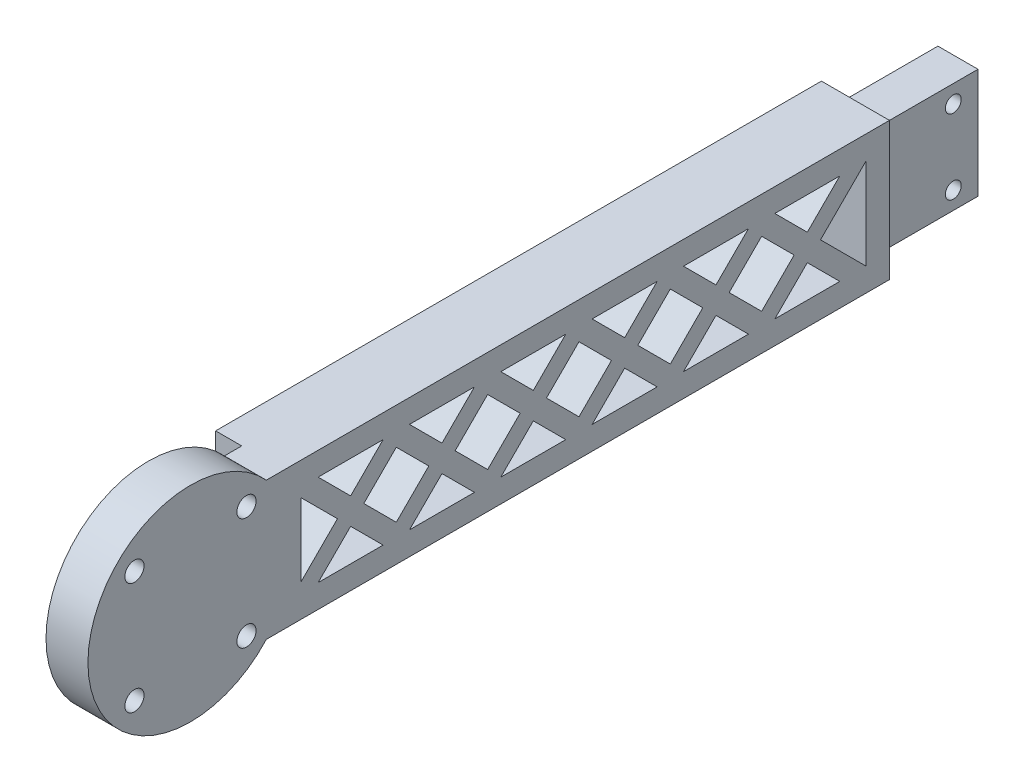
from build123d import *

# Parameters (mm, degrees)
SKETCH1_W               = 23.6
SKETCH1_H               = 8.6
BOSS_EXTRUDE1_DEPTH     = 22
SKETCH2_W               = 14.6
SKETCH2_H               = 29.6
BOSS_EXTRUDE2_DEPTH     = 130
SKETCH3_R               = 1.7
CUT_EXTRUDE1_DEPTH      = 9
CUT_EXTRUDE2_DEPTH      = 154.533959474
CUT_EXTRUDE2_DEPTH_BACK = 19
SKETCH5_R               = 2.06
BOSS_EXTRUDE3_DEPTH     = 9


with BuildPart() as part:
    # Sketch1 → Boss-Extrude1 (new body)
    with BuildSketch(Plane(origin=(0, 0, 0), x_dir=(0, 1, 0), z_dir=(0, 0, 1))):
        with Locations((-1.18489011, 2.334615385)):
            Rectangle(SKETCH1_W, SKETCH1_H)
    extrude(amount=BOSS_EXTRUDE1_DEPTH)

    # Sketch2 → Boss-Extrude2 (add)
    with BuildSketch(Plane.XY.offset(22)):
        with Locations((-2.334615385, -1.18489011)):
            Rectangle(SKETCH2_W, SKETCH2_H)
    extrude(amount=BOSS_EXTRUDE2_DEPTH)

    # Sketch3 → Cut-Extrude1 (cut)
    with BuildSketch(Plane.YZ.offset(1.965384615)):
        with Locations(Location((6.81510989, 5.3, 0), (0, 0, 270))):
            Circle(SKETCH3_R)
        with Locations(Location((-9.18489011, 5.3, 0), (0, 0, 270))):
            Circle(SKETCH3_R)
    extrude(amount=-CUT_EXTRUDE1_DEPTH, mode=Mode.SUBTRACT)

    # Sketch4 → Cut-Extrude2 (cut, two sides: drawn at the far end of the back side and taken through both)
    with BuildSketch(Plane.YZ.offset(4.965384615).offset(-CUT_EXTRUDE2_DEPTH_BACK)):
        Polygon((-4.013317235, 118.028427125), (-10.98489011, 125), (-10.98489011, 111.056854249), align=None)
        Polygon((4.958255641, 127), (-7.32803586, 127), (-1.18489011, 120.856854249), align=None)
        Polygon((8.61510989, 125), (1.643537015, 118.028427125), (8.61510989, 111.056854249), align=None)
        Polygon((-1.18489011, 115.2), (-8.156462985, 108.228427125), (-1.18489011, 101.256854249), (5.786682765, 108.228427125), align=None)
        Polygon((-4.013317235, 98.428427125), (-10.98489011, 105.4), (-10.98489011, 91.456854249), align=None)
        Polygon((8.61510989, 105.4), (1.643537015, 98.428427125), (8.61510989, 91.456854249), align=None)
        Polygon((-1.18489011, 95.6), (-8.156462985, 88.628427125), (-1.18489011, 81.656854249), (5.786682765, 88.628427125), align=None)
        Polygon((-4.013317235, 78.828427125), (-10.98489011, 85.8), (-10.98489011, 71.856854249), align=None)
        Polygon((8.61510989, 85.8), (1.643537015, 78.828427125), (8.61510989, 71.856854249), align=None)
        Polygon((-1.18489011, 76), (-8.156462985, 69.028427125), (-1.18489011, 62.056854249), (5.786682765, 69.028427125), align=None)
        Polygon((-10.98489011, 66.2), (-10.98489011, 52.256854249), (-4.013317235, 59.228427125), align=None)
        Polygon((1.643537015, 59.228427125), (8.61510989, 52.256854249), (8.61510989, 66.2), align=None)
        Polygon((-1.18489011, 56.4), (-8.156462985, 49.428427125), (-1.18489011, 42.456854249), (5.786682765, 49.428427125), align=None)
        Polygon((-10.98489011, 46.6), (-10.98489011, 32.656854249), (-4.013317235, 39.628427125), align=None)
        Polygon((1.643537015, 39.628427125), (8.61510989, 32.656854249), (8.61510989, 46.6), align=None)
        Polygon((-1.18489011, 36.8), (-10.98489011, 27), (8.61510989, 27), align=None)
        Polygon((-8.156462985, 127.828427125), (-7.32803586, 127), (4.958255641, 127), (5.786682765, 127.828427125), (-1.18489011, 134.8), align=None)
        Polygon((-10.98489011, 144.6), (-10.98489011, 130.656854249), (-4.013317235, 137.628427125), align=None)
        Polygon((-8.98489011, 148.256854249), (-1.18489011, 140.456854249), (6.61510989, 148.256854249), align=None)
        Polygon((8.61510989, 144.6), (1.643537015, 137.628427125), (8.61510989, 130.656854249), align=None)
    extrude(amount=CUT_EXTRUDE2_DEPTH + CUT_EXTRUDE2_DEPTH_BACK, mode=Mode.SUBTRACT)

    # Sketch5 → Boss-Extrude3 (add)
    # profile 1 of 3: a face of its own
    with BuildSketch(Plane.YZ.offset(4.965384615)):
        with BuildLine():
            Line((-15.98489011, 155.72240804), (-15.98489011, 152))
            Line((-15.98489011, 152), (-10.3500415, 152))
            ThreePointArc((-10.3500415, 152), (-13.311150898, 153.643698648), (-15.98489011, 155.72240804))
        make_face()
    # profile 2 of 3: a face of its own
    with BuildSketch(Plane.YZ.offset(4.965384615)):
        with BuildLine():
            ThreePointArc((13.61510989, 155.72240804), (10.941370678, 153.643698648), (7.98026128, 152))
            Line((7.98026128, 152), (13.61510989, 152))
            Line((13.61510989, 152), (13.61510989, 155.72240804))
        make_face()
    # profile 3 of 3: a face of its own
    with BuildSketch(Plane.YZ.offset(4.965384615)):
        with BuildLine():
            ThreePointArc((20.81510989, 172), (-10.084328294, 192.119642144), (-15.98489011, 155.72240804))
            ThreePointArc((-15.98489011, 155.72240804), (-13.311150898, 153.643698648), (-10.3500415, 152))
            Line((-10.3500415, 152), (7.98026128, 152))
            ThreePointArc((7.98026128, 152), (10.941370678, 153.643698648), (13.61510989, 155.72240804))
            ThreePointArc((13.61510989, 155.72240804), (18.934752034, 163.100561815), (20.81510989, 172))
        make_face()
        with Locations((-13.20570539, 159.97918472)):
            Circle(SKETCH5_R, mode=Mode.SUBTRACT)
        with Locations((-13.20570539, 184.02081528)):
            Circle(SKETCH5_R, mode=Mode.SUBTRACT)
        with Locations((10.83592517, 159.97918472)):
            Circle(SKETCH5_R, mode=Mode.SUBTRACT)
        with Locations((10.83592517, 184.02081528)):
            Circle(SKETCH5_R, mode=Mode.SUBTRACT)
    extrude(amount=-BOSS_EXTRUDE3_DEPTH)


solid = part.part
